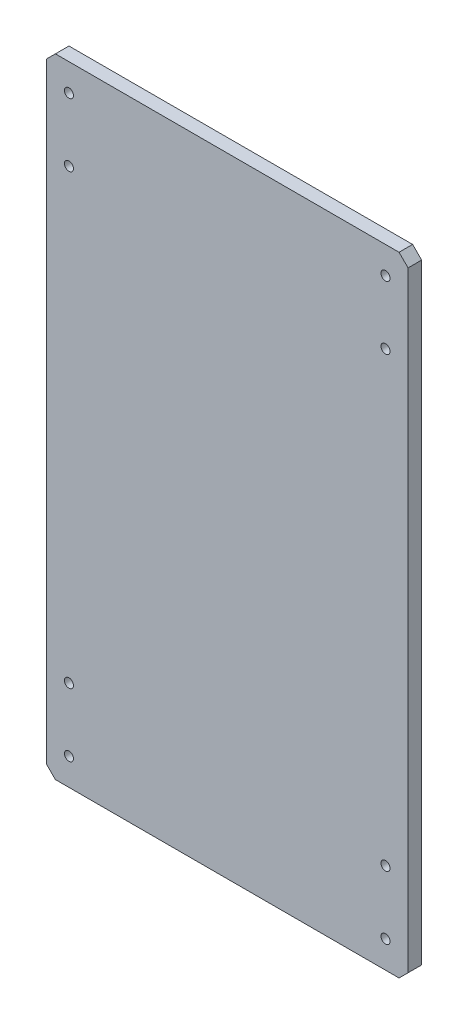
from build123d import *

# Parameters (mm, degrees)
SKETCH1_R           = 1
BOSS_EXTRUDE1_DEPTH = 3


with BuildPart() as part:
    # Sketch1 → Boss-Extrude1 (new body)
    with BuildSketch(Plane.XY.offset(3)):
        Polygon((-38, -69.5), (38, -69.5), (40, -67.5), (40, 67.5), (38, 69.5), (-38, 69.5), (-40, 67.5), (-40, -67.5), align=None)
        with Locations(Location((35, 49.5, 0), (0, 0, 180))):
            Circle(SKETCH1_R, mode=Mode.SUBTRACT)
        with Locations(Location((-35, -63.5, 0), (0, 0, 180))):
            Circle(SKETCH1_R, mode=Mode.SUBTRACT)
        with Locations(Location((35, 63.5, 0), (0, 0, 180))):
            Circle(SKETCH1_R, mode=Mode.SUBTRACT)
        with Locations(Location((-35, -49.5, 0), (0, 0, 180))):
            Circle(SKETCH1_R, mode=Mode.SUBTRACT)
        with Locations(Location((-35, 49.5, 0), (0, 0, 180))):
            Circle(SKETCH1_R, mode=Mode.SUBTRACT)
        with Locations(Location((-35, 63.5, 0), (0, 0, 180))):
            Circle(SKETCH1_R, mode=Mode.SUBTRACT)
        with Locations(Location((35, -49.5, 0), (0, 0, 180))):
            Circle(SKETCH1_R, mode=Mode.SUBTRACT)
        with Locations(Location((35, -63.5, 0), (0, 0, 180))):
            Circle(SKETCH1_R, mode=Mode.SUBTRACT)
    extrude(amount=-BOSS_EXTRUDE1_DEPTH)


solid = part.part
